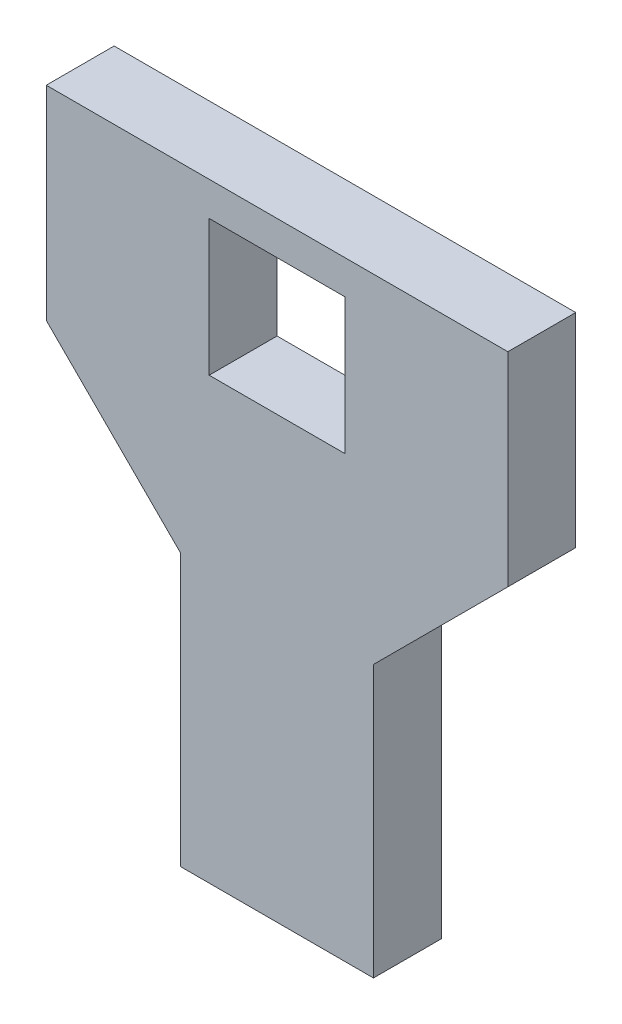
from build123d import *

# Parameters (mm, degrees)
CROQUIS1_W              = 34
CROQUIS1_H              = 15
CROQUIS1_W_2            = 10
CROQUIS1_H_2            = 10
SALIENTE_EXTRUIR1_DEPTH = 5


with BuildPart() as part:
    # Croquis1 → Saliente-Extruir1 (new body)
    # profile 1 of 2: a face of its own
    with BuildSketch(Plane.XY):
        Rectangle(CROQUIS1_W, CROQUIS1_H)
        Rectangle(CROQUIS1_W_2, CROQUIS1_H_2, mode=Mode.SUBTRACT)
    # profile 2 of 2: a face of its own
    with BuildSketch(Plane.XY):
        Polygon((17, -7.5), (7.100505063, -17.399494937), (7.100505063, -37.399494937), (-7.100505063, -37.399494937), (-7.100505063, -17.399494937), (-17, -7.5), align=None)
    extrude(amount=SALIENTE_EXTRUIR1_DEPTH)


solid = part.part
